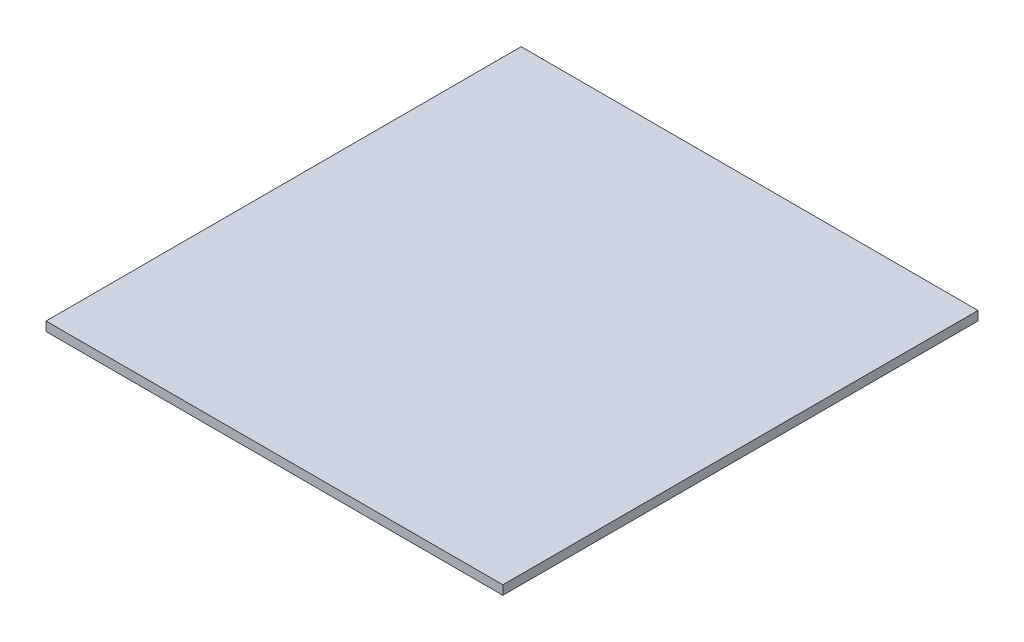
from build123d import *

# Parameters (mm, degrees)
SKETCH1_W  = 200
SKETCH1_H  = 208
BODY_DEPTH = 4


with BuildPart() as part:
    # Sketch1 → body (new body)
    with BuildSketch(Plane(origin=(0, 0, 0), x_dir=(1, 0, 0), z_dir=(0, 1, 0))):
        Rectangle(SKETCH1_W, SKETCH1_H)
    extrude(amount=BODY_DEPTH)


solid = part.part
